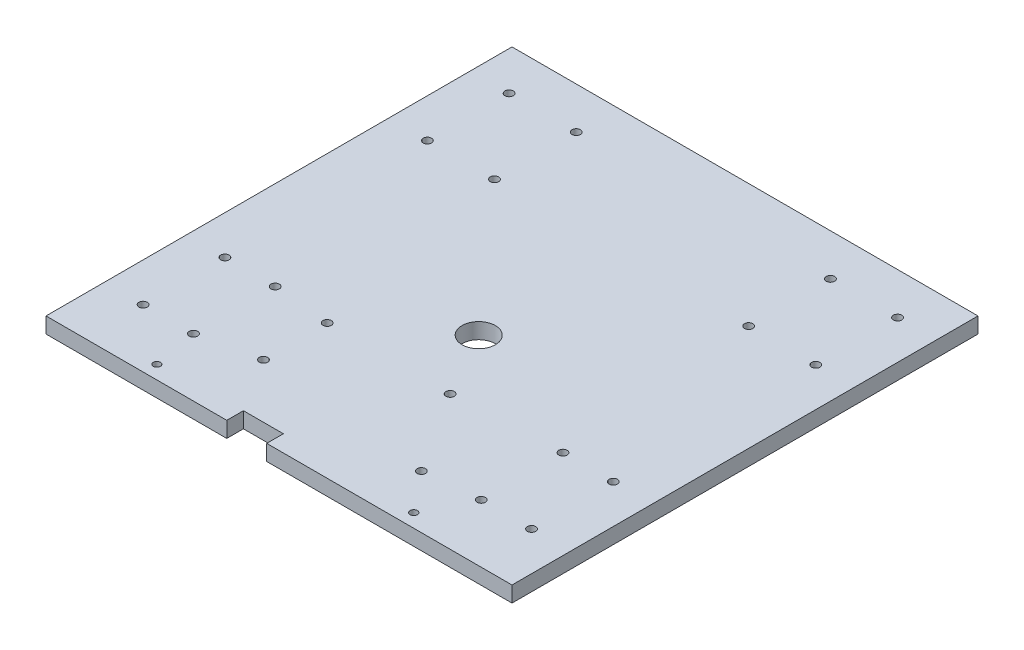
from build123d import *

# Parameters (mm, degrees)
SKETCH1_W               = 177.8
SKETCH1_H               = 177.8
BOSS_EXTRUDE1_DEPTH     = 5.9944
CUT_EXTRUDE1_DEPTH      = 252.51861329
CUT_EXTRUDE1_DEPTH_BACK = 5.9944
SKETCH5_R               = 1.6
CUT_EXTRUDE2_DEPTH      = 252.51861329
CUT_EXTRUDE2_DEPTH_BACK = 252.51861329
SKETCH6_W               = 15.24
SKETCH6_H               = 6.35
CUT_EXTRUDE3_DEPTH      = 252.51861329
CUT_EXTRUDE3_DEPTH_BACK = 252.51861329
SKETCH7_R               = 1.6
CUT_EXTRUDE4_DEPTH      = 252.51861329
CUT_EXTRUDE4_DEPTH_BACK = 252.51861329
SKETCH8_R               = 6.35
CUT_EXTRUDE5_DEPTH      = 252.51861329
CUT_EXTRUDE5_DEPTH_BACK = 252.51861329
SKETCH9_R               = 1.363261963
SKETCH9_R_2             = 1.386126721


with BuildPart() as part:
    # Sketch1 → Boss-Extrude1 (new body)
    with BuildSketch(Plane(origin=(0, 0, 0), x_dir=(1, 0, 0), z_dir=(0, 1, 0))):
        with Locations((88.9, 88.9)):
            Rectangle(SKETCH1_W, SKETCH1_H)
    extrude(amount=BOSS_EXTRUDE1_DEPTH)

    # Sketch5 → Cut-Extrude1 (cut, two sides: drawn at the far end of the back side and taken through both)
    with BuildSketch(Plane.XZ.offset(-CUT_EXTRUDE1_DEPTH_BACK)):
        with Locations(Location((163, -22.25, 0), (0, 0, 270))):
            Circle(SKETCH5_R)
        with Locations(Location((163, -53.45, 0), (0, 0, 270))):
            Circle(SKETCH5_R)
        with Locations(Location((143.8, -22.25, 0), (0, 0, 270))):
            Circle(SKETCH5_R)
        with Locations(Location((143.8, -53.45, 0), (0, 0, 270))):
            Circle(SKETCH5_R)
        with Locations(Location((14.8, -22.25, 0), (0, 0, 270))):
            Circle(SKETCH5_R)
        with Locations(Location((14.8, -53.45, 0), (0, 0, 270))):
            Circle(SKETCH5_R)
        with Locations(Location((40.4, -130.7, 0), (0, 0, 270))):
            Circle(SKETCH5_R)
        with Locations(Location((14.8, -130.7, 0), (0, 0, 270))):
            Circle(SKETCH5_R)
        with Locations(Location((14.8, -161.9, 0), (0, 0, 270))):
            Circle(SKETCH5_R)
        with Locations(Location((40.4, -161.9, 0), (0, 0, 270))):
            Circle(SKETCH5_R)
        with Locations(Location((163, -130.7, 0), (0, 0, 270))):
            Circle(SKETCH5_R)
        with Locations(Location((163, -161.9, 0), (0, 0, 270))):
            Circle(SKETCH5_R)
        with Locations(Location((137.4, -130.7, 0), (0, 0, 270))):
            Circle(SKETCH5_R)
        with Locations(Location((137.4, -161.9, 0), (0, 0, 270))):
            Circle(SKETCH5_R)
        with Locations(Location((34, -22.25, 0), (0, 0, 270))):
            Circle(SKETCH5_R)
        with Locations(Location((34, -53.45, 0), (0, 0, 270))):
            Circle(SKETCH5_R)
    extrude(amount=CUT_EXTRUDE1_DEPTH + CUT_EXTRUDE1_DEPTH_BACK, mode=Mode.SUBTRACT)

    # Sketch6 → Cut-Extrude2 (cut, two sides: drawn at the far end of the back side and taken through both)
    with BuildSketch(Plane(origin=(0, 5.9944, 0), x_dir=(1, 0, 0), z_dir=(0, 1, 0)).offset(-CUT_EXTRUDE2_DEPTH_BACK)):
        with Locations((76.5936, 3.175)):
            Rectangle(SKETCH6_W, SKETCH6_H)
    extrude(amount=CUT_EXTRUDE2_DEPTH + CUT_EXTRUDE2_DEPTH_BACK, mode=Mode.SUBTRACT)

    # Sketch7 → Cut-Extrude3 (cut, two sides: drawn at the far end of the back side and taken through both)
    with BuildSketch(Plane(origin=(0, 5.9944, 0), x_dir=(1, 0, 0), z_dir=(0, 1, 0)).offset(-CUT_EXTRUDE3_DEPTH_BACK)):
        with Locations(Location((55.9736, 51.32, 0), (0, 0, 270))):
            Circle(SKETCH7_R)
        with Locations(Location((102.855, 51.32, 0), (0, 0, 270))):
            Circle(SKETCH7_R)
        with Locations(Location((122.855, 20.35, 0), (0, 0, 270))):
            Circle(SKETCH7_R)
        with Locations(Location((55.9736, 27, 0), (0, 0, 270))):
            Circle(SKETCH7_R)
    extrude(amount=CUT_EXTRUDE3_DEPTH + CUT_EXTRUDE3_DEPTH_BACK, mode=Mode.SUBTRACT)

    # Sketch8 → Cut-Extrude4 (cut, two sides: drawn at the far end of the back side and taken through both)
    with BuildSketch(Plane(origin=(0, 5.9944, 0), x_dir=(1, 0, 0), z_dir=(0, 1, 0)).offset(-CUT_EXTRUDE4_DEPTH_BACK)):
        with Locations(Location((88.9, 76.2, 0), (0, 0, 270))):
            Circle(SKETCH8_R)
    extrude(amount=CUT_EXTRUDE4_DEPTH + CUT_EXTRUDE4_DEPTH_BACK, mode=Mode.SUBTRACT)

    # Sketch9 → Cut-Extrude5 (cut, two sides: drawn at the far end of the back side and taken through both)
    with BuildSketch(Plane(origin=(0, 0, 0), x_dir=(-1, 0, 0), z_dir=(0, -1, 0)).offset(-CUT_EXTRUDE5_DEPTH_BACK)):
        with Locations(Location((-37.15, 5.16, 0), (0, 0, 90))):
            Circle(SKETCH9_R)
        with Locations(Location((-135.15, 5.16, 0), (0, 0, 90))):
            Circle(SKETCH9_R_2)
    extrude(amount=CUT_EXTRUDE5_DEPTH + CUT_EXTRUDE5_DEPTH_BACK, mode=Mode.SUBTRACT)


solid = part.part
